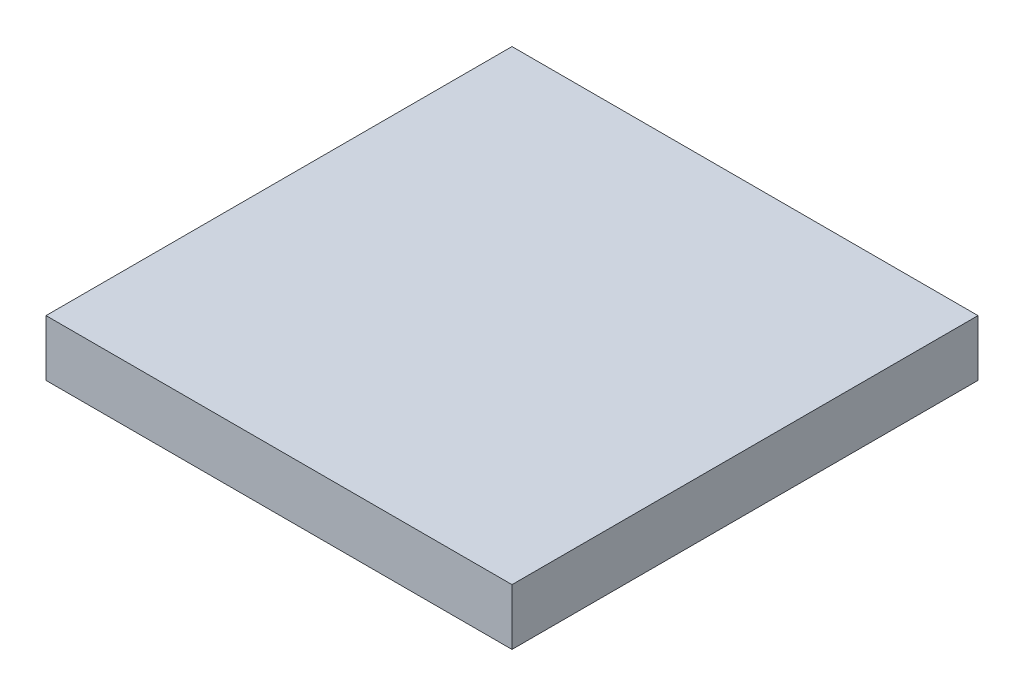
from build123d import *

# Parameters (mm, degrees)
SKETCH1_W      = 8.3
SKETCH1_H      = 8.3
CHIP_LID_DEPTH = 1


with BuildPart() as part:
    # Sketch1 → chip_lid (new body)
    with BuildSketch(Plane(origin=(0, 0, 0), x_dir=(1, 0, 0), z_dir=(0, 1, 0))):
        Rectangle(SKETCH1_W, SKETCH1_H)
    extrude(amount=CHIP_LID_DEPTH)


solid = part.part
